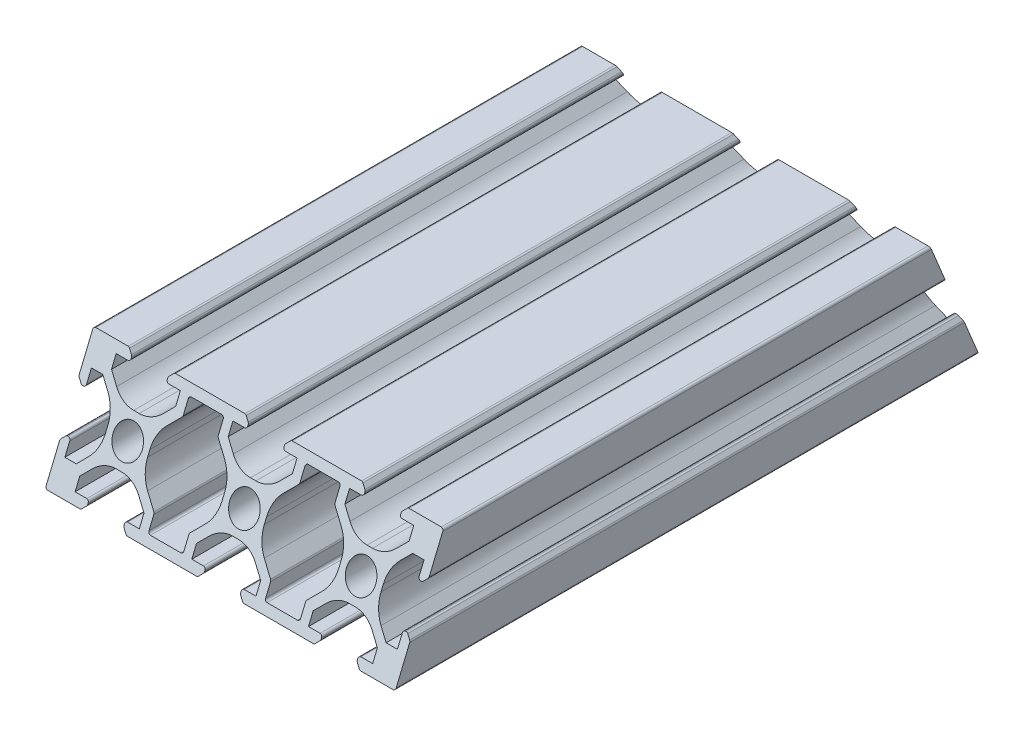
from build123d import *

# Parameters (mm, degrees)
RESSALTO_EXTRUS_O1_DEPTH    = 100
PADR_OCIRCULAR1_COUNT       = 4
PADR_O_LINEAR1_COUNT        = 3
PADR_O_LINEAR1_PITCH        = 20
PADR_O_LINEAR1_COPY_1_DEPTH = 100
PADR_O_LINEAR1_COPY_2_DEPTH = 100
PADR_O_LINEAR1_COPY_3_DEPTH = 100
PADR_O_LINEAR1_COPY_4_DEPTH = 100
PADR_O_LINEAR1_COPY_5_DEPTH = 100
PADR_O_LINEAR1_COPY_6_DEPTH = 100
CORTE_EXTRUS_O1_DEPTH       = 113.249721603
PADR_O_LINEAR2_COUNT        = 2
PADR_O_LINEAR2_PITCH        = 20
FILETE1_R                   = 0.4
FILETE2_R                   = 0.4
CUT_EXTRUDE1_DEPTH          = 118.046999107


with BuildPart() as part:
    # Esboço1 → Ressalto-extrusão1 (new body)
    with BuildSketch(Plane.XY):
        with BuildLine():
            ThreePointArc((-9.317157288, 3.217157288), (-9.187387948, 3.130448187), (-9.034314575, 3.1))
            Line((-9.034314575, 3.1), (-8.9, 3.1))
            ThreePointArc((-8.9, 3.1), (-8.617157288, 3.217157288), (-8.5, 3.5))
            Line((-8.5, 3.5), (-8.5, 5.5))
            Line((-8.5, 5.5), (-6.560660172, 5.5))
            Line((-6.560660172, 5.5), (-5.064466094, 4.003805922))
            ThreePointArc((-5.064466094, 4.003805922), (-3.980602337, 2.381689178), (-3.6, 0.468272016))
            Line((-3.6, 0.468272016), (-3.6, 0))
            Line((-3.6, 0), (-2.5, 0))
            ThreePointArc((-2.5, 0), (-1.767766953, 1.767766953), (0, 2.5))
            Line((0, 2.5), (0, 3.6))
            Line((0, 3.6), (-0.468272016, 3.6))
            ThreePointArc((-0.468272016, 3.6), (-2.381689178, 3.980602337), (-4.003805922, 5.064466094))
            Line((-4.003805922, 5.064466094), (-5.5, 6.560660172))
            Line((-5.5, 6.560660172), (-5.5, 8.5))
            Line((-5.5, 8.5), (-3.5, 8.5))
            ThreePointArc((-3.5, 8.5), (-3.217157288, 8.617157288), (-3.1, 8.9))
            Line((-3.1, 8.9), (-3.1, 9.034314575))
            ThreePointArc((-3.1, 9.034314575), (-3.130448187, 9.187387948), (-3.217157288, 9.317157288))
            Line((-3.217157288, 9.317157288), (-3.782842712, 9.882842712))
            ThreePointArc((-3.782842712, 9.882842712), (-3.912612052, 9.969551813), (-4.065685425, 10))
            Line((-4.065685425, 10), (-10, 10))
            Line((-10, 10), (-10, 4.065685425))
            ThreePointArc((-10, 4.065685425), (-9.969551813, 3.912612052), (-9.882842712, 3.782842712))
            Line((-9.882842712, 3.782842712), (-9.317157288, 3.217157288))
        make_face()
    ressalto_extrus_o1 = extrude(amount=RESSALTO_EXTRUS_O1_DEPTH)

    # PadrãoCircular1: Ressalto-extrusão1 ×4 about axis
    padr_ocircular1_axis = Axis((0, 0, 0), (0, 0, 1))
    for i in range(1, PADR_OCIRCULAR1_COUNT):
        add(ressalto_extrus_o1.rotate(padr_ocircular1_axis, i * 360 / PADR_OCIRCULAR1_COUNT))

    # Padrão linear1: Ressalto-extrusão1 ×3
    with Locations(*[(i * PADR_O_LINEAR1_PITCH, 0, 0) for i in range(1, PADR_O_LINEAR1_COUNT)]):
        add(ressalto_extrus_o1)

    # Padrão linear1 copy 1 sketch → Padrão linear1 copy 1 (add)
    with BuildSketch(Plane(origin=(20, 0, 0), x_dir=(0, 1, 0), z_dir=(0, 0, 1))):
        with BuildLine():
            ThreePointArc((-9.317157288, 3.217157288), (-9.187387948, 3.130448187), (-9.034314575, 3.1))
            Line((-9.034314575, 3.1), (-8.9, 3.1))
            ThreePointArc((-8.9, 3.1), (-8.617157288, 3.217157288), (-8.5, 3.5))
            Line((-8.5, 3.5), (-8.5, 5.5))
            Line((-8.5, 5.5), (-6.560660172, 5.5))
            Line((-6.560660172, 5.5), (-5.064466094, 4.003805922))
            ThreePointArc((-5.064466094, 4.003805922), (-3.980602337, 2.381689178), (-3.6, 0.468272016))
            Line((-3.6, 0.468272016), (-3.6, 0))
            Line((-3.6, 0), (-2.5, 0))
            ThreePointArc((-2.5, 0), (-1.767766953, 1.767766953), (0, 2.5))
            Line((0, 2.5), (0, 3.6))
            Line((0, 3.6), (-0.468272016, 3.6))
            ThreePointArc((-0.468272016, 3.6), (-2.381689178, 3.980602337), (-4.003805922, 5.064466094))
            Line((-4.003805922, 5.064466094), (-5.5, 6.560660172))
            Line((-5.5, 6.560660172), (-5.5, 8.5))
            Line((-5.5, 8.5), (-3.5, 8.5))
            ThreePointArc((-3.5, 8.5), (-3.217157288, 8.617157288), (-3.1, 8.9))
            Line((-3.1, 8.9), (-3.1, 9.034314575))
            ThreePointArc((-3.1, 9.034314575), (-3.130448187, 9.187387948), (-3.217157288, 9.317157288))
            Line((-3.217157288, 9.317157288), (-3.782842712, 9.882842712))
            ThreePointArc((-3.782842712, 9.882842712), (-3.912612052, 9.969551813), (-4.065685425, 10))
            Line((-4.065685425, 10), (-10, 10))
            Line((-10, 10), (-10, 4.065685425))
            ThreePointArc((-10, 4.065685425), (-9.969551813, 3.912612052), (-9.882842712, 3.782842712))
            Line((-9.882842712, 3.782842712), (-9.317157288, 3.217157288))
        make_face()
    extrude(amount=PADR_O_LINEAR1_COPY_1_DEPTH)

    # Padrão linear1 copy 2 sketch → Padrão linear1 copy 2 (add)
    with BuildSketch(Plane(origin=(40, 0, 0), x_dir=(0, 1, 0), z_dir=(0, 0, 1))):
        with BuildLine():
            ThreePointArc((-9.317157288, 3.217157288), (-9.187387948, 3.130448187), (-9.034314575, 3.1))
            Line((-9.034314575, 3.1), (-8.9, 3.1))
            ThreePointArc((-8.9, 3.1), (-8.617157288, 3.217157288), (-8.5, 3.5))
            Line((-8.5, 3.5), (-8.5, 5.5))
            Line((-8.5, 5.5), (-6.560660172, 5.5))
            Line((-6.560660172, 5.5), (-5.064466094, 4.003805922))
            ThreePointArc((-5.064466094, 4.003805922), (-3.980602337, 2.381689178), (-3.6, 0.468272016))
            Line((-3.6, 0.468272016), (-3.6, 0))
            Line((-3.6, 0), (-2.5, 0))
            ThreePointArc((-2.5, 0), (-1.767766953, 1.767766953), (0, 2.5))
            Line((0, 2.5), (0, 3.6))
            Line((0, 3.6), (-0.468272016, 3.6))
            ThreePointArc((-0.468272016, 3.6), (-2.381689178, 3.980602337), (-4.003805922, 5.064466094))
            Line((-4.003805922, 5.064466094), (-5.5, 6.560660172))
            Line((-5.5, 6.560660172), (-5.5, 8.5))
            Line((-5.5, 8.5), (-3.5, 8.5))
            ThreePointArc((-3.5, 8.5), (-3.217157288, 8.617157288), (-3.1, 8.9))
            Line((-3.1, 8.9), (-3.1, 9.034314575))
            ThreePointArc((-3.1, 9.034314575), (-3.130448187, 9.187387948), (-3.217157288, 9.317157288))
            Line((-3.217157288, 9.317157288), (-3.782842712, 9.882842712))
            ThreePointArc((-3.782842712, 9.882842712), (-3.912612052, 9.969551813), (-4.065685425, 10))
            Line((-4.065685425, 10), (-10, 10))
            Line((-10, 10), (-10, 4.065685425))
            ThreePointArc((-10, 4.065685425), (-9.969551813, 3.912612052), (-9.882842712, 3.782842712))
            Line((-9.882842712, 3.782842712), (-9.317157288, 3.217157288))
        make_face()
    extrude(amount=PADR_O_LINEAR1_COPY_2_DEPTH)

    # Padrão linear1 copy 3 sketch → Padrão linear1 copy 3 (add)
    with BuildSketch(Plane(origin=(20, 0, 0), x_dir=(-1, 0, 0), z_dir=(0, 0, 1))):
        with BuildLine():
            ThreePointArc((-9.317157288, 3.217157288), (-9.187387948, 3.130448187), (-9.034314575, 3.1))
            Line((-9.034314575, 3.1), (-8.9, 3.1))
            ThreePointArc((-8.9, 3.1), (-8.617157288, 3.217157288), (-8.5, 3.5))
            Line((-8.5, 3.5), (-8.5, 5.5))
            Line((-8.5, 5.5), (-6.560660172, 5.5))
            Line((-6.560660172, 5.5), (-5.064466094, 4.003805922))
            ThreePointArc((-5.064466094, 4.003805922), (-3.980602337, 2.381689178), (-3.6, 0.468272016))
            Line((-3.6, 0.468272016), (-3.6, 0))
            Line((-3.6, 0), (-2.5, 0))
            ThreePointArc((-2.5, 0), (-1.767766953, 1.767766953), (0, 2.5))
            Line((0, 2.5), (0, 3.6))
            Line((0, 3.6), (-0.468272016, 3.6))
            ThreePointArc((-0.468272016, 3.6), (-2.381689178, 3.980602337), (-4.003805922, 5.064466094))
            Line((-4.003805922, 5.064466094), (-5.5, 6.560660172))
            Line((-5.5, 6.560660172), (-5.5, 8.5))
            Line((-5.5, 8.5), (-3.5, 8.5))
            ThreePointArc((-3.5, 8.5), (-3.217157288, 8.617157288), (-3.1, 8.9))
            Line((-3.1, 8.9), (-3.1, 9.034314575))
            ThreePointArc((-3.1, 9.034314575), (-3.130448187, 9.187387948), (-3.217157288, 9.317157288))
            Line((-3.217157288, 9.317157288), (-3.782842712, 9.882842712))
            ThreePointArc((-3.782842712, 9.882842712), (-3.912612052, 9.969551813), (-4.065685425, 10))
            Line((-4.065685425, 10), (-10, 10))
            Line((-10, 10), (-10, 4.065685425))
            ThreePointArc((-10, 4.065685425), (-9.969551813, 3.912612052), (-9.882842712, 3.782842712))
            Line((-9.882842712, 3.782842712), (-9.317157288, 3.217157288))
        make_face()
    extrude(amount=PADR_O_LINEAR1_COPY_3_DEPTH)

    # Padrão linear1 copy 4 sketch → Padrão linear1 copy 4 (add)
    with BuildSketch(Plane(origin=(40, 0, 0), x_dir=(-1, 0, 0), z_dir=(0, 0, 1))):
        with BuildLine():
            ThreePointArc((-9.317157288, 3.217157288), (-9.187387948, 3.130448187), (-9.034314575, 3.1))
            Line((-9.034314575, 3.1), (-8.9, 3.1))
            ThreePointArc((-8.9, 3.1), (-8.617157288, 3.217157288), (-8.5, 3.5))
            Line((-8.5, 3.5), (-8.5, 5.5))
            Line((-8.5, 5.5), (-6.560660172, 5.5))
            Line((-6.560660172, 5.5), (-5.064466094, 4.003805922))
            ThreePointArc((-5.064466094, 4.003805922), (-3.980602337, 2.381689178), (-3.6, 0.468272016))
            Line((-3.6, 0.468272016), (-3.6, 0))
            Line((-3.6, 0), (-2.5, 0))
            ThreePointArc((-2.5, 0), (-1.767766953, 1.767766953), (0, 2.5))
            Line((0, 2.5), (0, 3.6))
            Line((0, 3.6), (-0.468272016, 3.6))
            ThreePointArc((-0.468272016, 3.6), (-2.381689178, 3.980602337), (-4.003805922, 5.064466094))
            Line((-4.003805922, 5.064466094), (-5.5, 6.560660172))
            Line((-5.5, 6.560660172), (-5.5, 8.5))
            Line((-5.5, 8.5), (-3.5, 8.5))
            ThreePointArc((-3.5, 8.5), (-3.217157288, 8.617157288), (-3.1, 8.9))
            Line((-3.1, 8.9), (-3.1, 9.034314575))
            ThreePointArc((-3.1, 9.034314575), (-3.130448187, 9.187387948), (-3.217157288, 9.317157288))
            Line((-3.217157288, 9.317157288), (-3.782842712, 9.882842712))
            ThreePointArc((-3.782842712, 9.882842712), (-3.912612052, 9.969551813), (-4.065685425, 10))
            Line((-4.065685425, 10), (-10, 10))
            Line((-10, 10), (-10, 4.065685425))
            ThreePointArc((-10, 4.065685425), (-9.969551813, 3.912612052), (-9.882842712, 3.782842712))
            Line((-9.882842712, 3.782842712), (-9.317157288, 3.217157288))
        make_face()
    extrude(amount=PADR_O_LINEAR1_COPY_4_DEPTH)

    # Padrão linear1 copy 5 sketch → Padrão linear1 copy 5 (add)
    with BuildSketch(Plane(origin=(20, 0, 0), x_dir=(0, -1, 0), z_dir=(0, 0, 1))):
        with BuildLine():
            ThreePointArc((-9.317157288, 3.217157288), (-9.187387948, 3.130448187), (-9.034314575, 3.1))
            Line((-9.034314575, 3.1), (-8.9, 3.1))
            ThreePointArc((-8.9, 3.1), (-8.617157288, 3.217157288), (-8.5, 3.5))
            Line((-8.5, 3.5), (-8.5, 5.5))
            Line((-8.5, 5.5), (-6.560660172, 5.5))
            Line((-6.560660172, 5.5), (-5.064466094, 4.003805922))
            ThreePointArc((-5.064466094, 4.003805922), (-3.980602337, 2.381689178), (-3.6, 0.468272016))
            Line((-3.6, 0.468272016), (-3.6, 0))
            Line((-3.6, 0), (-2.5, 0))
            ThreePointArc((-2.5, 0), (-1.767766953, 1.767766953), (0, 2.5))
            Line((0, 2.5), (0, 3.6))
            Line((0, 3.6), (-0.468272016, 3.6))
            ThreePointArc((-0.468272016, 3.6), (-2.381689178, 3.980602337), (-4.003805922, 5.064466094))
            Line((-4.003805922, 5.064466094), (-5.5, 6.560660172))
            Line((-5.5, 6.560660172), (-5.5, 8.5))
            Line((-5.5, 8.5), (-3.5, 8.5))
            ThreePointArc((-3.5, 8.5), (-3.217157288, 8.617157288), (-3.1, 8.9))
            Line((-3.1, 8.9), (-3.1, 9.034314575))
            ThreePointArc((-3.1, 9.034314575), (-3.130448187, 9.187387948), (-3.217157288, 9.317157288))
            Line((-3.217157288, 9.317157288), (-3.782842712, 9.882842712))
            ThreePointArc((-3.782842712, 9.882842712), (-3.912612052, 9.969551813), (-4.065685425, 10))
            Line((-4.065685425, 10), (-10, 10))
            Line((-10, 10), (-10, 4.065685425))
            ThreePointArc((-10, 4.065685425), (-9.969551813, 3.912612052), (-9.882842712, 3.782842712))
            Line((-9.882842712, 3.782842712), (-9.317157288, 3.217157288))
        make_face()
    extrude(amount=PADR_O_LINEAR1_COPY_5_DEPTH)

    # Padrão linear1 copy 6 sketch → Padrão linear1 copy 6 (add)
    with BuildSketch(Plane(origin=(40, 0, 0), x_dir=(0, -1, 0), z_dir=(0, 0, 1))):
        with BuildLine():
            ThreePointArc((-9.317157288, 3.217157288), (-9.187387948, 3.130448187), (-9.034314575, 3.1))
            Line((-9.034314575, 3.1), (-8.9, 3.1))
            ThreePointArc((-8.9, 3.1), (-8.617157288, 3.217157288), (-8.5, 3.5))
            Line((-8.5, 3.5), (-8.5, 5.5))
            Line((-8.5, 5.5), (-6.560660172, 5.5))
            Line((-6.560660172, 5.5), (-5.064466094, 4.003805922))
            ThreePointArc((-5.064466094, 4.003805922), (-3.980602337, 2.381689178), (-3.6, 0.468272016))
            Line((-3.6, 0.468272016), (-3.6, 0))
            Line((-3.6, 0), (-2.5, 0))
            ThreePointArc((-2.5, 0), (-1.767766953, 1.767766953), (0, 2.5))
            Line((0, 2.5), (0, 3.6))
            Line((0, 3.6), (-0.468272016, 3.6))
            ThreePointArc((-0.468272016, 3.6), (-2.381689178, 3.980602337), (-4.003805922, 5.064466094))
            Line((-4.003805922, 5.064466094), (-5.5, 6.560660172))
            Line((-5.5, 6.560660172), (-5.5, 8.5))
            Line((-5.5, 8.5), (-3.5, 8.5))
            ThreePointArc((-3.5, 8.5), (-3.217157288, 8.617157288), (-3.1, 8.9))
            Line((-3.1, 8.9), (-3.1, 9.034314575))
            ThreePointArc((-3.1, 9.034314575), (-3.130448187, 9.187387948), (-3.217157288, 9.317157288))
            Line((-3.217157288, 9.317157288), (-3.782842712, 9.882842712))
            ThreePointArc((-3.782842712, 9.882842712), (-3.912612052, 9.969551813), (-4.065685425, 10))
            Line((-4.065685425, 10), (-10, 10))
            Line((-10, 10), (-10, 4.065685425))
            ThreePointArc((-10, 4.065685425), (-9.969551813, 3.912612052), (-9.882842712, 3.782842712))
            Line((-9.882842712, 3.782842712), (-9.317157288, 3.217157288))
        make_face()
    extrude(amount=PADR_O_LINEAR1_COPY_6_DEPTH)

    # Esboço4 → Corte-extrusão1 (cut, through all)
    with BuildSketch(Plane(origin=(0, 0, 0), x_dir=(-1, 0, 0), z_dir=(0, 0, -1))):
        Polygon((-13.439339828, 5.5), (-13, 5.939339828), (-13, 8.5), (-7, 8.5), (-7, 5.939339828), (-6.560660172, 5.5), (-6.560660172, -5.5), (-7, -5.939339828), (-7, -8.5), (-13, -8.5), (-13, -5.939339828), (-13.439339828, -5.5), align=None)
    corte_extrus_o1 = extrude(amount=-CORTE_EXTRUS_O1_DEPTH, mode=Mode.SUBTRACT)

    # Padrão linear2: Corte-extrusão1 ×2
    with Locations(*[(i * PADR_O_LINEAR2_PITCH, 0, 0) for i in range(1, PADR_O_LINEAR2_COUNT)]):
        add(corte_extrus_o1, mode=Mode.SUBTRACT)

    # Filete1
    filete1_edges = [part.edges().sort_by_distance(p)[0] for p in [
        (13, 5.939339828, 50),
        (13, 8.5, 50),
        (7, 8.5, 50),
        (7, 5.939339828, 50),
        (7, -5.939339828, 50),
        (7, -8.5, 50),
        (13, -8.5, 50),
        (13, -5.939339828, 50),
        (33, 5.939339828, 50),
        (33, 8.5, 50),
        (27, 8.5, 50),
        (27, 5.939339828, 50),
        (27, -5.939339828, 50),
        (27, -8.5, 50),
        (33, -8.5, 50),
        (33, -5.939339828, 50),
    ]]
    fillet(filete1_edges, radius=FILETE1_R)

    # Filete2
    filete2_edges = [part.edges().sort_by_distance(p)[0] for p in [
        (-10, 10, 50),
        (50, -10, 50),
        (50, 10, 50),
        (-10, -10, 50),
    ]]
    fillet(filete2_edges, radius=FILETE2_R)

    # Sketch1 → Cut-Extrude1 (cut, through all)
    with BuildSketch(Plane.ZY.offset(10)):
        Polygon((0, 0), (0, -10), (12.426406871, 20), (0, 20), align=None)
        Polygon((87.573593129, 20), (100, 20), (100, 0), (100, -10), align=None)
    extrude(amount=-CUT_EXTRUDE1_DEPTH, mode=Mode.SUBTRACT)


solid = part.part
